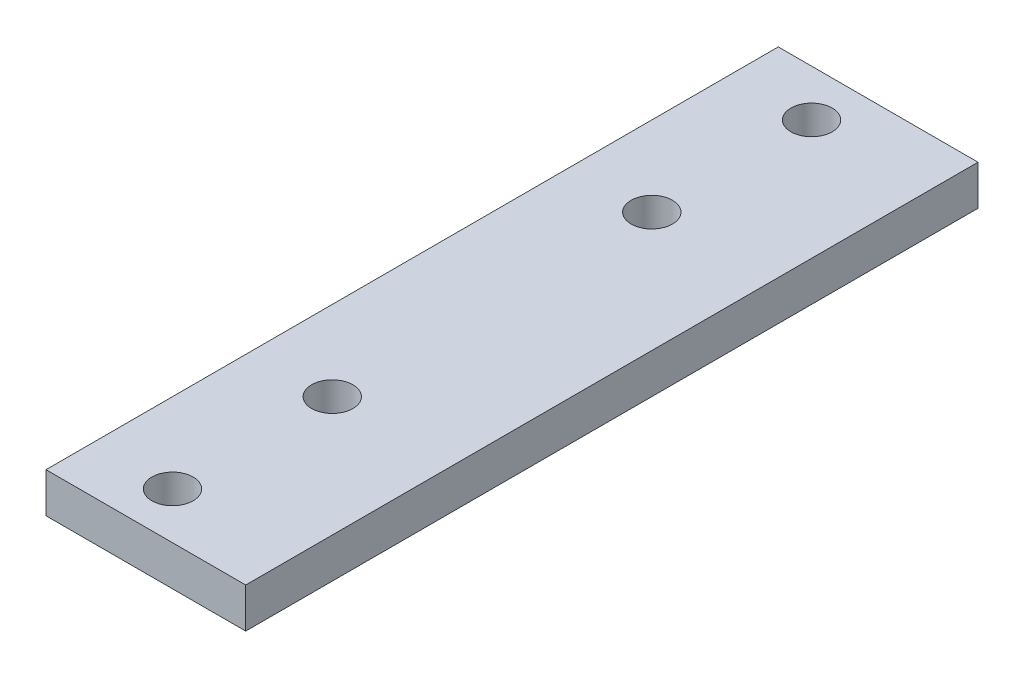
from build123d import *

# Parameters (mm, degrees)
BOSS_EXTRUDE1_DEPTH = 45
SKETCH2_W           = 31
SKETCH2_H           = 37
BOSS_EXTRUDE3_START = -45
BOSS_EXTRUDE3_DEPTH = 45
SKETCH4_R           = 5.05
CUT_EXTRUDE1_DEPTH  = 12
SKETCH5_W           = 5
SKETCH5_H           = 35
CUT_EXTRUDE2_DEPTH  = 67.895440801
BOSS_EXTRUDE5_DEPTH = 37
BOSS_EXTRUDE6_START = 5
SKETCH7_W           = 17.5
SKETCH7_H           = 7.441015215
BOSS_EXTRUDE6_DEPTH = 5
SKETCH9_W           = 15
SKETCH9_H           = 55
SKETCH9_W_2         = 10
BOSS_EXTRUDE7_DEPTH = 3
SKETCH12_R          = 1.55
CUT_EXTRUDE5_DEPTH  = 5
SKETCH13_W          = 7
SKETCH13_H          = 4
CUT_EXTRUDE6_DEPTH  = 90.162772501
CUT_EXTRUDE7_DEPTH  = 74.993242935


with BuildPart() as part:
    # Sketch1 → Boss-Extrude1 (new body)
    with BuildSketch(Plane.XY):
        with BuildLine():
            Line((35, 0), (-35, 0))
            ThreePointArc((-35, 0), (0, -35), (35, 0))
        make_face()
    extrude(amount=BOSS_EXTRUDE1_DEPTH)

    # Sketch2 → Cut-Revolve1 (revolve, cut)
    with BuildSketch(Plane(origin=(0, 0, 0), x_dir=(1, 0, 0), z_dir=(0, 1, 0))):
        with Locations((-15.5, -22.5)):
            Rectangle(SKETCH2_W, SKETCH2_H)
    revolve(axis=Axis((0, 0, 0), (0, 0, 1)), mode=Mode.SUBTRACT)

    # Sketch3 → Boss-Extrude3 (add)
    with BuildSketch(Plane.XY.offset(45).offset(BOSS_EXTRUDE3_START)):
        with BuildLine():
            Line((-17.5, -30.310889132), (-17.5, 0))
            Line((-17.5, 0), (-35, 0))
            Line((-35, 0), (-35, -35))
            Line((-35, -35), (0, -35))
            ThreePointArc((0, -35), (-9.058666579, -33.80740392), (-17.5, -30.310889132))
        make_face()
    extrude(amount=BOSS_EXTRUDE3_DEPTH)

    # Sketch4 → Cut-Extrude1 (cut)
    with BuildSketch(Plane.ZY.offset(35)):
        with Locations((10, -17.5)):
            Circle(SKETCH4_R)
        with Locations((35, -17.5)):
            Circle(SKETCH4_R)
    extrude(amount=-CUT_EXTRUDE1_DEPTH, mode=Mode.SUBTRACT)

    # Sketch5 → Cut-Extrude2 (cut, through all)
    with BuildSketch(Plane(origin=(0, 0, 0), x_dir=(-1, 0, 0), z_dir=(0, 0, -1))):
        with Locations((32.5, -17.5)):
            Rectangle(SKETCH5_W, SKETCH5_H)
    extrude(amount=-CUT_EXTRUDE2_DEPTH, mode=Mode.SUBTRACT)

    # Sketch6 → Boss-Extrude5 (add)
    with BuildSketch(Plane(origin=(0, 0, 41), x_dir=(-1, 0, 0), z_dir=(0, 0, -1))):
        with BuildLine():
            ThreePointArc((-31, 0), (-25.966324345, -16.933694222), (-12.5, -28.368115905))
            Line((-12.5, -28.368115905), (-12.5, 0))
            Line((-12.5, 0), (-31, 0))
        make_face()
        with BuildLine():
            Line((12.5, 0), (12.5, -28.368115905))
            ThreePointArc((12.5, -28.368115905), (15.064267175, -27.093686617), (17.5, -25.588083164))
            Line((17.5, -25.588083164), (17.5, 0))
            Line((17.5, 0), (12.5, 0))
        make_face()
    extrude(amount=BOSS_EXTRUDE5_DEPTH)

    # Sketch7 → Boss-Extrude6 (add)
    with BuildSketch(Plane(origin=(0, 0, 0), x_dir=(-1, 0, 0), z_dir=(0, 0, -1)).offset(BOSS_EXTRUDE6_START)):
        with BuildLine():
            Line((-12.5, 0), (-35, 0))
            ThreePointArc((-35, 0), (-34.799393274, -3.741955075), (-34.199872698, -7.441015215))
            Line((-34.199872698, -7.441015215), (-12.5, -7.441015215))
            Line((-12.5, -7.441015215), (-12.5, 0))
        make_face()
        with Locations((21.25, -3.720507608)):
            Rectangle(SKETCH7_W, SKETCH7_H)
    boss_extrude6 = extrude(amount=-BOSS_EXTRUDE6_DEPTH)

    # Mirror1: Boss-Extrude6 across plane
    add(boss_extrude6.mirror(Plane(origin=(0, 0, 22.5), x_dir=(1, 0, 0), z_dir=(0, 0, -1))))

    # Sketch9 → Boss-Extrude7 (add)
    with BuildSketch(Plane(origin=(0, 0, 0), x_dir=(1, 0, 0), z_dir=(0, 1, 0))):
        with Locations((27.5, -22.5)):
            Rectangle(SKETCH9_W, SKETCH9_H)
        with Locations((-25, -22.5)):
            Rectangle(SKETCH9_W_2, SKETCH9_H)
    extrude(amount=BOSS_EXTRUDE7_DEPTH)

    # Sketch12 → Cut-Extrude5 (cut)
    with BuildSketch(Plane(origin=(0, 3, 0), x_dir=(1, 0, 0), z_dir=(0, 1, 0))):
        with Locations((26, 1.5)):
            Circle(SKETCH12_R)
        with Locations((26, -10.5)):
            Circle(SKETCH12_R)
        with Locations((26, -34.5)):
            Circle(SKETCH12_R)
        with Locations((26, -46.5)):
            Circle(SKETCH12_R)
        with Locations((-26, 1.5)):
            Circle(SKETCH12_R)
        with Locations((-26, -10.5)):
            Circle(SKETCH12_R)
        with Locations((-26, -34.5)):
            Circle(SKETCH12_R)
        with Locations((-26, -46.5)):
            Circle(SKETCH12_R)
    extrude(amount=-CUT_EXTRUDE5_DEPTH, mode=Mode.SUBTRACT)

    # Sketch13 → Cut-Extrude6 (cut, through all)
    with BuildSketch(Plane(origin=(35, 0, 0), x_dir=(0, 0, -1), z_dir=(1, 0, 0))):
        with Locations((-46.5, -2)):
            Rectangle(SKETCH13_W, SKETCH13_H)
        with Locations((-34.5, -2)):
            Rectangle(SKETCH13_W, SKETCH13_H)
        with Locations((-10.5, -2)):
            Rectangle(SKETCH13_W, SKETCH13_H)
        with Locations((1.5, -2)):
            Rectangle(SKETCH13_W, SKETCH13_H)
    extrude(amount=-CUT_EXTRUDE6_DEPTH, mode=Mode.SUBTRACT)

    # Sketch14 → Cut-Extrude7 (cut, through all)
    with BuildSketch(Plane.XY.offset(50)):
        Polygon((-17.094187338, 0), (35.300582727, 0), (35.300582727, -35.487417881), (-30, -35.487417881), (-30, 0), (-30, 9.051842105), (-17.094187338, 9.051842105), align=None)
    extrude(amount=-CUT_EXTRUDE7_DEPTH, mode=Mode.SUBTRACT)


solid = part.part
